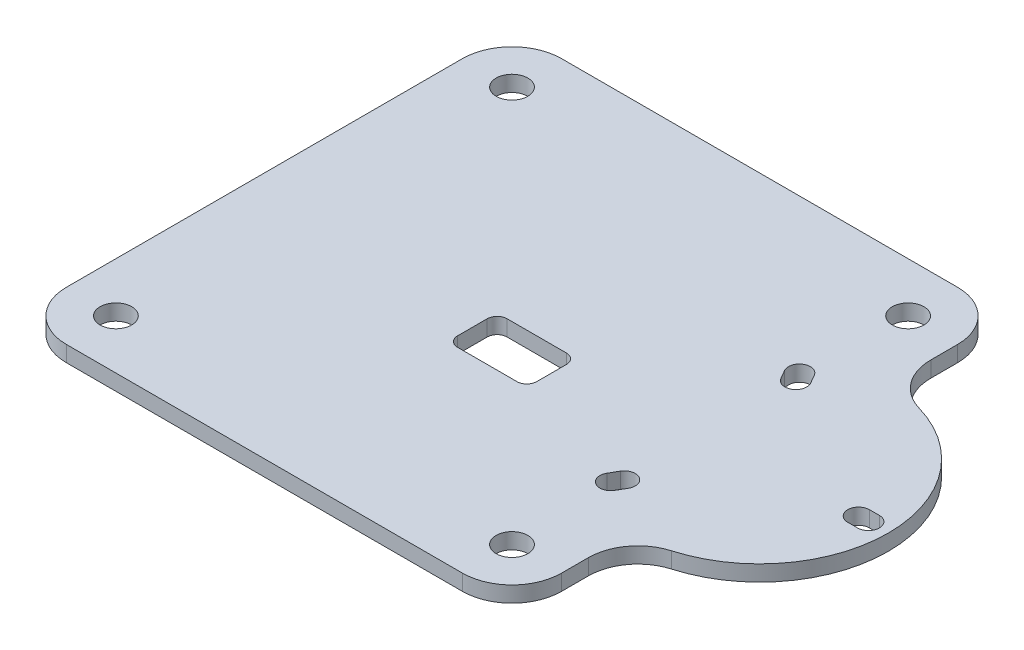
from build123d import *

# Parameters (mm, degrees)
BOSS_EXTRUDE1_DEPTH = 1.6
FILLET1_R           = 5
CUT_EXTRUDE1_DEPTH  = 56.924592086
SKETCH3_R           = 1.6
CUT_EXTRUDE2_DEPTH  = 56.924592086
FILLET2_R           = 5
SKETCH4_W           = 8
SKETCH4_H           = 5
CUT_EXTRUDE3_DEPTH  = 56.924592086
FILLET3_R           = 1


with BuildPart() as part:
    # Sketch1 → Boss-Extrude1 (new body)
    with BuildSketch(Plane(origin=(0, 0, 0), x_dir=(1, 0, 0), z_dir=(0, 1, 0))):
        with BuildLine():
            Line((-50, 25), (-50, -25))
            Line((-50, -25), (0, -25))
            Line((0, -25), (0, -13))
            ThreePointArc((0, -13), (13, 0), (0, 13))
            Line((0, 13), (0, 25))
            Line((0, 25), (-50, 25))
        make_face()
    extrude(amount=BOSS_EXTRUDE1_DEPTH)

    # Fillet1
    fillet1_edges = [part.edges().sort_by_distance(p)[0] for p in [
        (-50, 0.8, 25),
        (-50, 0.8, -25),
        (0, 0.8, -25),
        (0, 0.8, 25),
    ]]
    fillet(fillet1_edges, radius=FILLET1_R)

    # Sketch2 → Cut-Extrude1 (cut, through all)
    with BuildSketch(Plane(origin=(0, 0, 0), x_dir=(1, 0, 0), z_dir=(0, 1, 0))):
        with BuildLine():
            Line((-6.452627944, -8.976279442), (-5.952627944, -8.110254038))
            ThreePointArc((-5.952627944, -8.110254038), (-4.45, -7.707626094), (-4.047372056, -9.210254038))
            Line((-4.047372056, -9.210254038), (-4.547372056, -10.076279442))
            ThreePointArc((-4.547372056, -10.076279442), (-6.05, -10.478907386), (-6.452627944, -8.976279442))
        make_face()
        with BuildLine():
            Line((10, 1.1), (11, 1.1))
            ThreePointArc((11, 1.1), (12.1, 0), (11, -1.1))
            Line((11, -1.1), (10, -1.1))
            ThreePointArc((10, -1.1), (8.9, 0), (10, 1.1))
        make_face()
        with BuildLine():
            Line((-5.952627944, 8.110254038), (-6.452627944, 8.976279442))
            ThreePointArc((-6.452627944, 8.976279442), (-6.05, 10.478907386), (-4.547372056, 10.076279442))
            Line((-4.547372056, 10.076279442), (-4.047372056, 9.210254038))
            ThreePointArc((-4.047372056, 9.210254038), (-4.45, 7.707626094), (-5.952627944, 8.110254038))
        make_face()
    extrude(amount=CUT_EXTRUDE1_DEPTH, mode=Mode.SUBTRACT)

    # Sketch3 → Cut-Extrude2 (cut, through all)
    with BuildSketch(Plane(origin=(0, 0, 0), x_dir=(1, 0, 0), z_dir=(0, 1, 0))):
        with Locations((-45, 20)):
            Circle(SKETCH3_R)
        with Locations((-5, 20)):
            Circle(SKETCH3_R)
        with Locations((-5, -20)):
            Circle(SKETCH3_R)
        with Locations((-45, -20)):
            Circle(SKETCH3_R)
    extrude(amount=CUT_EXTRUDE2_DEPTH, mode=Mode.SUBTRACT)

    # Fillet2
    fillet2_edges = [part.edges().sort_by_distance(p)[0] for p in [
        (0, 0.8, -13),
        (0, 0.8, 13),
    ]]
    fillet(fillet2_edges, radius=FILLET2_R)

    # Sketch4 → Cut-Extrude3 (cut, through all)
    with BuildSketch(Plane.XZ):
        with Locations((-22, 3)):
            Rectangle(SKETCH4_W, SKETCH4_H)
    extrude(amount=-CUT_EXTRUDE3_DEPTH, mode=Mode.SUBTRACT)

    # Fillet3
    fillet3_edges = [part.edges().sort_by_distance(p)[0] for p in [
        (-18, 0.8, 5.5),
        (-18, 0.8, 0.5),
        (-26, 0.8, 0.5),
        (-26, 0.8, 5.5),
    ]]
    fillet(fillet3_edges, radius=FILLET3_R)


solid = part.part
